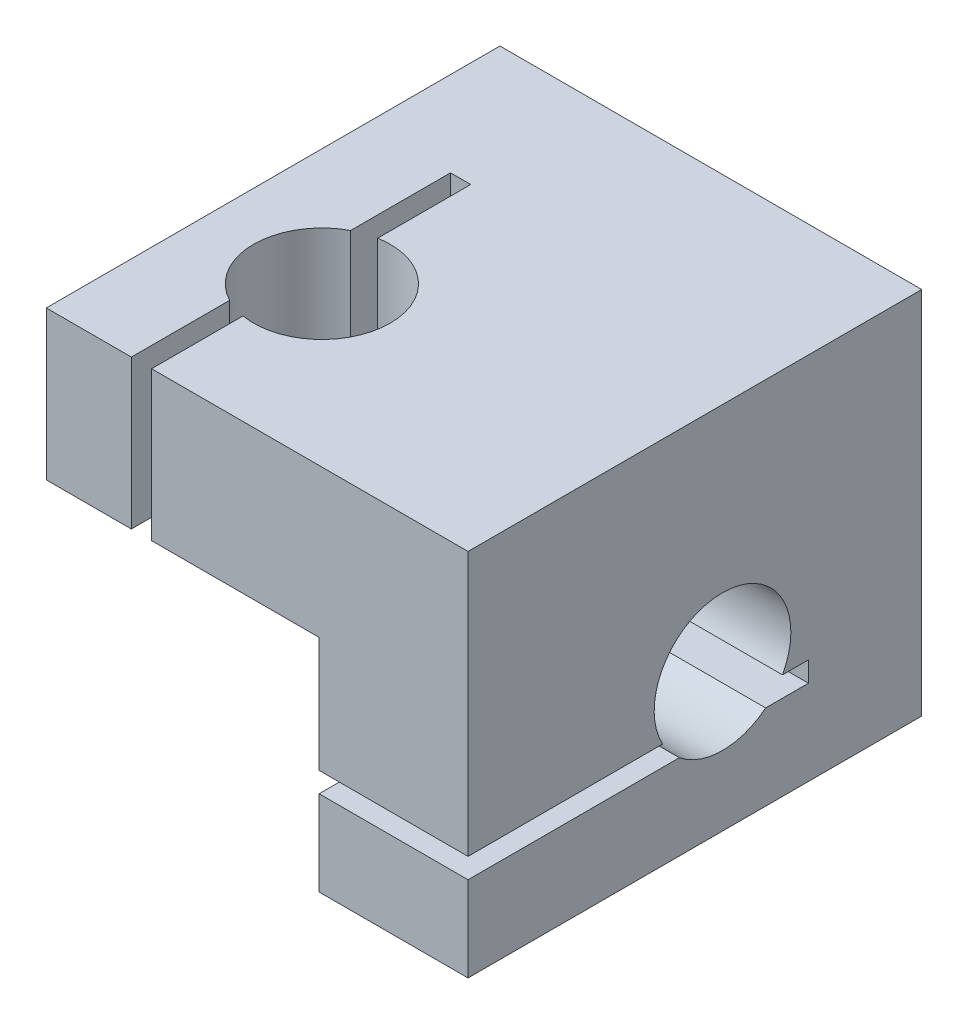
from build123d import *

# Parameters (mm, degrees)
BOSS_EXTRUDE1_DEPTH             = 42.65
SKETCH2_R                       = 6.425
CUT_EXTRUDE1_DEPTH              = 42.65
SKETCH3_W                       = 1.9
SKETCH3_H                       = 30
CUT_EXTRUDE2_DEPTH              = 42.65
SKETCH4_R                       = 6.425
CUT_EXTRUDE3_DEPTH              = 42.65
SKETCH5_W                       = 32
SKETCH5_H                       = 1.9
CUT_EXTRUDE4_DEPTH              = 42.65
M3X0_5_TAPPED_HOLE1_D           = 2.5
M3X0_5_TAPPED_HOLE1_DEPTH       = 10
M3X0_5_TAPPED_HOLE1_CSINK_D     = 3.05
M3X0_5_TAPPED_HOLE1_CSINK_ANGLE = 90
M3X0_5_TAPPED_HOLE1_TIP         = 0.751075774


with BuildPart() as part:
    # Sketch1 → Boss-Extrude1 (new body)
    with BuildSketch(Plane.XY):
        Polygon((14, 0), (-25.65, 0), (-25.65, -14), (0, -14), (0, -34.73), (14, -34.73), align=None)
    extrude(amount=BOSS_EXTRUDE1_DEPTH)

    # Sketch2 → Cut-Extrude1 (cut)
    with BuildSketch(Plane.XZ.offset(14)):
        with Locations((-14.665, 27.725)):
            Circle(SKETCH2_R)
    extrude(amount=-CUT_EXTRUDE1_DEPTH, mode=Mode.SUBTRACT)

    # Sketch3 → Cut-Extrude2 (cut)
    with BuildSketch(Plane.XZ.offset(14)):
        with Locations((-16.7, 27.65)):
            Rectangle(SKETCH3_W, SKETCH3_H)
    extrude(amount=-CUT_EXTRUDE2_DEPTH, mode=Mode.SUBTRACT)

    # Sketch4 → Cut-Extrude3 (cut)
    with BuildSketch(Plane.ZY):
        with Locations((18.725, -21.745)):
            Circle(SKETCH4_R)
    extrude(amount=-CUT_EXTRUDE3_DEPTH, mode=Mode.SUBTRACT)

    # Sketch5 → Cut-Extrude4 (cut)
    with BuildSketch(Plane.ZY):
        with Locations((26.65, -25.78)):
            Rectangle(SKETCH5_W, SKETCH5_H)
    extrude(amount=-CUT_EXTRUDE4_DEPTH, mode=Mode.SUBTRACT)

    # M3x0.5 Tapped Hole1
    with Locations(Plane(origin=(0, 0, 0), x_dir=(-1, 0, 0), z_dir=(0, 0, -1))):
        with Locations((1.1, -5.25), (13.5, -5.25), (-6.99, -21.8)):
            CounterSinkHole(M3X0_5_TAPPED_HOLE1_D / 2, M3X0_5_TAPPED_HOLE1_CSINK_D / 2, depth=M3X0_5_TAPPED_HOLE1_DEPTH, counter_sink_angle=M3X0_5_TAPPED_HOLE1_CSINK_ANGLE)
            with Locations((0, 0, -(M3X0_5_TAPPED_HOLE1_DEPTH + M3X0_5_TAPPED_HOLE1_TIP / 2))):  # 118° drill point
                Cone(0, M3X0_5_TAPPED_HOLE1_D / 2, M3X0_5_TAPPED_HOLE1_TIP, mode=Mode.SUBTRACT)


solid = part.part
